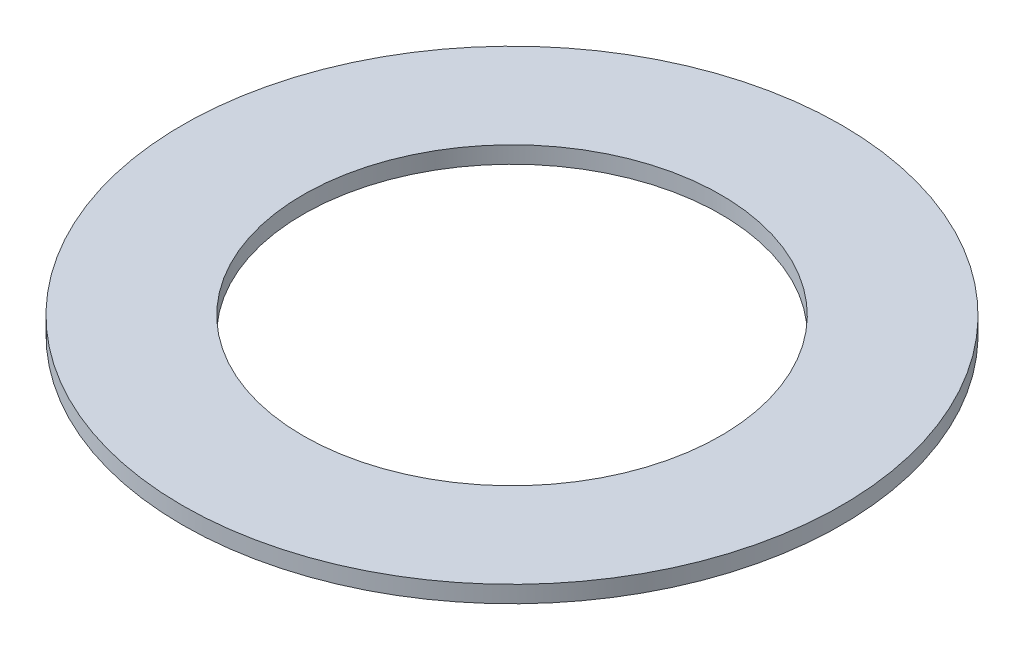
from build123d import *

# Parameters (mm, degrees)
SKETCH1_R           = 78.2
SKETCH1_R_2         = 49.55
BOSS_EXTRUDE1_DEPTH = 4


with BuildPart() as part:
    # Sketch1 → Boss-Extrude1 (new body)
    with BuildSketch(Plane(origin=(0, 0, 0), x_dir=(1, 0, 0), z_dir=(0, 1, 0))):
        with Locations(Location((0, 0, 0), (0, 0, 270))):
            Circle(SKETCH1_R)
        with Locations(Location((0, 0, 0), (0, 0, 270))):
            Circle(SKETCH1_R_2, mode=Mode.SUBTRACT)
    extrude(amount=BOSS_EXTRUDE1_DEPTH)


solid = part.part
